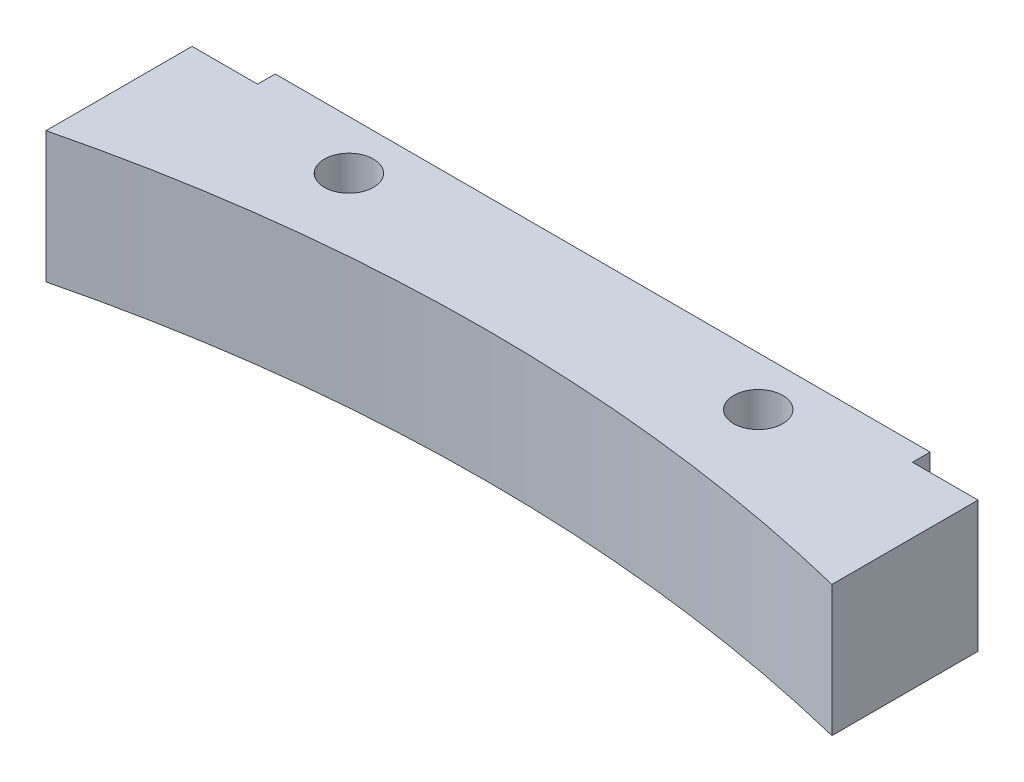
from build123d import *

# Parameters (mm, degrees)
BOSS_EXTRUDE1_DEPTH = 4
SKETCH10_R          = 1.5
SKETCH10_W          = 40
SKETCH10_H          = 6.922711204
CUT_EXTRUDE2_DEPTH  = 31.436460939


with BuildPart() as part:
    # Sketch1 → Boss-Extrude1 (new, symmetric)
    with BuildSketch(Plane(origin=(0, 0, 0), x_dir=(1, 0, 0), z_dir=(0, 1, 0))):
        with BuildLine():
            Line((-20, 0), (0, 0))
            Line((0, 0), (20, 0))
            Line((20, 0), (20, -8))
            Line((20, -8), (24, -8))
            Line((24, -8), (24, -16.922711204))
            ThreePointArc((24, -16.922711204), (0, -14), (-24, -16.922711204))
            Line((-24, -16.922711204), (-24, -8))
            Line((-24, -8), (-20, -8))
            Line((-20, -8), (-20, 0))
        make_face()
    extrude(amount=BOSS_EXTRUDE1_DEPTH, both=True)

    # Sketch10 → Cut-Extrude2 (cut, through all)
    with BuildSketch(Plane(origin=(0, 4, 0), x_dir=(1, 0, 0), z_dir=(0, 1, 0))):
        with Locations(Location((-12.5, -9.922711204, 0), (0, 0, 270))):
            Circle(SKETCH10_R)
        with Locations(Location((12.5, -9.922711204, 0), (0, 0, 270))):
            Circle(SKETCH10_R)
        with Locations((0, -3.461355602)):
            Rectangle(SKETCH10_W, SKETCH10_H)
    extrude(amount=-CUT_EXTRUDE2_DEPTH, mode=Mode.SUBTRACT)


solid = part.part
